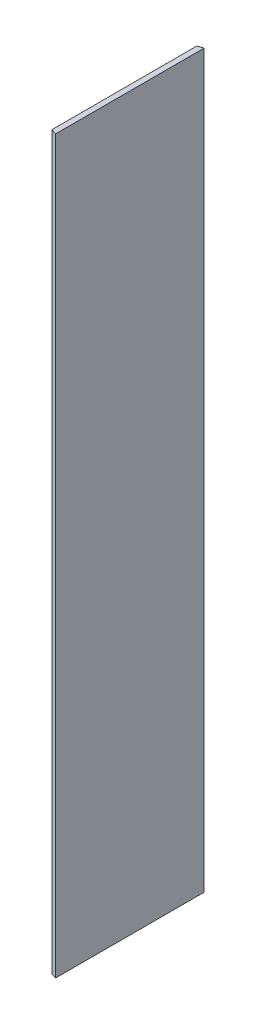
from build123d import *

# Parameters (mm, degrees)
EXTRUDE_1_DEPTH = 533.213673317


with BuildPart() as part:
    # Эскиз1 → Вытянуть1 (new body)
    with BuildSketch(Plane(origin=(0, 0, 0), x_dir=(1, 0, 0), z_dir=(0, 1, 0))):
        Polygon((1.009644716, -0.830240311), (1.009644716, -106.580095426), (5.009644716, -107.836003295), (5.009644716, 0.498838058), align=None)
    extrude(amount=EXTRUDE_1_DEPTH)


solid = part.part
